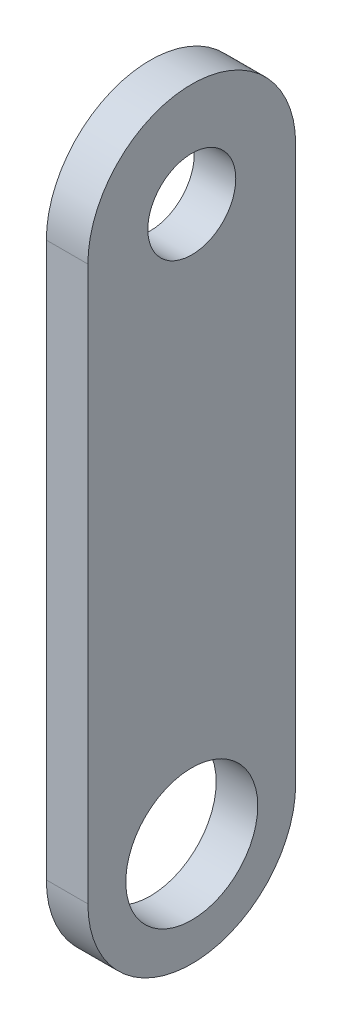
from build123d import *

# Parameters (mm, degrees)
SKETCH3_W           = 15
SKETCH3_H           = 55
BOSS_EXTRUDE1_DEPTH = 3
SKETCH4_R           = 3.175
SKETCH4_R_2         = 4.7625
CUT_EXTRUDE1_DEPTH  = 5
FILLET3_RADIUS      = 7.5
FILLET3_LENGTH      = 3
FILLET4_RADIUS      = 7.5
FILLET4_LENGTH      = 3


with BuildPart() as part:
    # Sketch3 → Boss-Extrude1 (new body)
    with BuildSketch(Plane(origin=(0, 0, 0), x_dir=(0, 0, -1), z_dir=(1, 0, 0))):
        Rectangle(SKETCH3_W, SKETCH3_H)
    extrude(amount=BOSS_EXTRUDE1_DEPTH)

    # Sketch4 → Cut-Extrude1 (cut)
    with BuildSketch(Plane(origin=(3, 0, 0), x_dir=(0, 0, -1), z_dir=(1, 0, 0))):
        with Locations((0, 20)):
            Circle(SKETCH4_R)
        with Locations((0, -20)):
            Circle(SKETCH4_R_2)
    extrude(amount=-CUT_EXTRUDE1_DEPTH, mode=Mode.SUBTRACT)

    # Fillet3: full round fillet: the end face becomes a half cylinder, R = half its width
    fillet3_face = Plane((1.5, 27.5, 0), x_dir=(-1, 0, 0), z_dir=(0, 1, 0))  # on the end face: x along it, z out of the body
    fillet3_slab = fillet3_face.offset(-FILLET3_RADIUS / 2) * Box(FILLET3_LENGTH, 2 * FILLET3_RADIUS, FILLET3_RADIUS, mode=Mode.PRIVATE)  # the body's end, R deep
    fillet3_round = Plane((1.5, 20, 0), x_dir=(0, 1, 0), z_dir=(-1, 0, 0)) * Cylinder(FILLET3_RADIUS, FILLET3_LENGTH, mode=Mode.PRIVATE)  # its axis R under the face
    add(fillet3_slab - fillet3_round, mode=Mode.SUBTRACT)

    # Fillet4: full round fillet: the end face becomes a half cylinder, R = half its width
    fillet4_face = Plane((1.5, -27.5, 0), x_dir=(-1, 0, 0), z_dir=(0, -1, 0))  # on the end face: x along it, z out of the body
    fillet4_slab = fillet4_face.offset(-FILLET4_RADIUS / 2) * Box(FILLET4_LENGTH, 2 * FILLET4_RADIUS, FILLET4_RADIUS, mode=Mode.PRIVATE)  # the body's end, R deep
    fillet4_round = Plane((1.5, -20, 0), x_dir=(0, -1, 0), z_dir=(-1, 0, 0)) * Cylinder(FILLET4_RADIUS, FILLET4_LENGTH, mode=Mode.PRIVATE)  # its axis R under the face
    add(fillet4_slab - fillet4_round, mode=Mode.SUBTRACT)


solid = part.part
